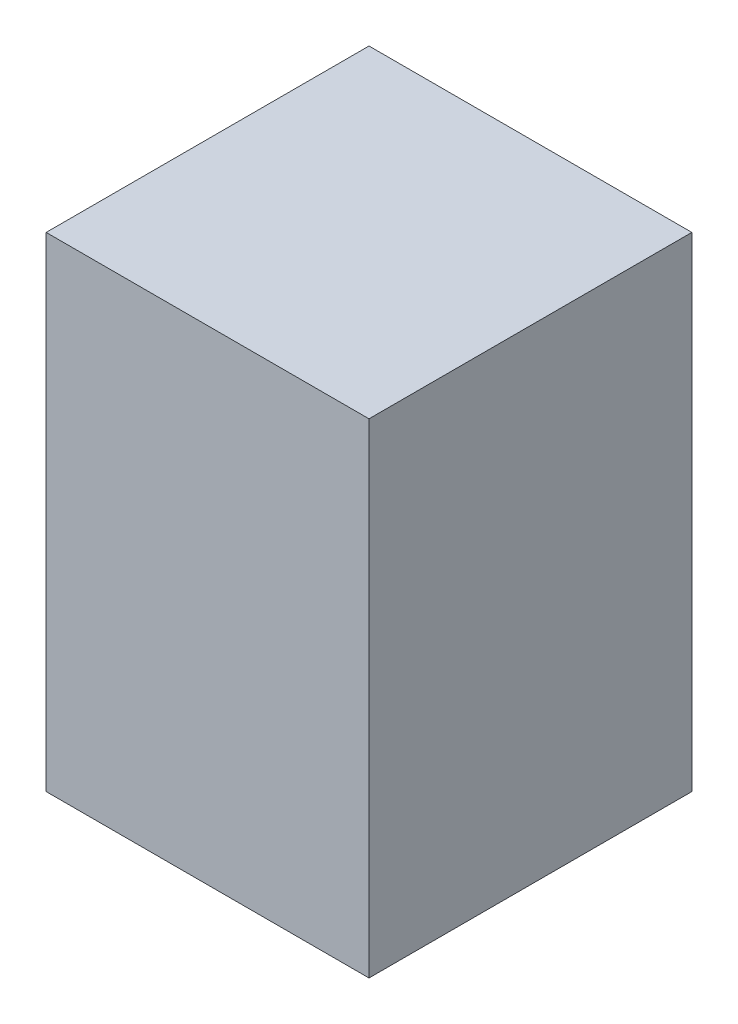
from build123d import *

# Parameters (mm, degrees)
STORE_AYAK_3_1_START = -680
SKETCH1_W            = 80
SKETCH1_H            = 120
STORE_AYAK_3_1_DEPTH = 80


with BuildPart() as part:
    # Sketch1 → STORE_ayak_3_1 (new body)
    with BuildSketch(Plane.XY.offset(STORE_AYAK_3_1_START)):
        with Locations((100, 60)):
            Rectangle(SKETCH1_W, SKETCH1_H)
    extrude(amount=-STORE_AYAK_3_1_DEPTH)


solid = part.part
